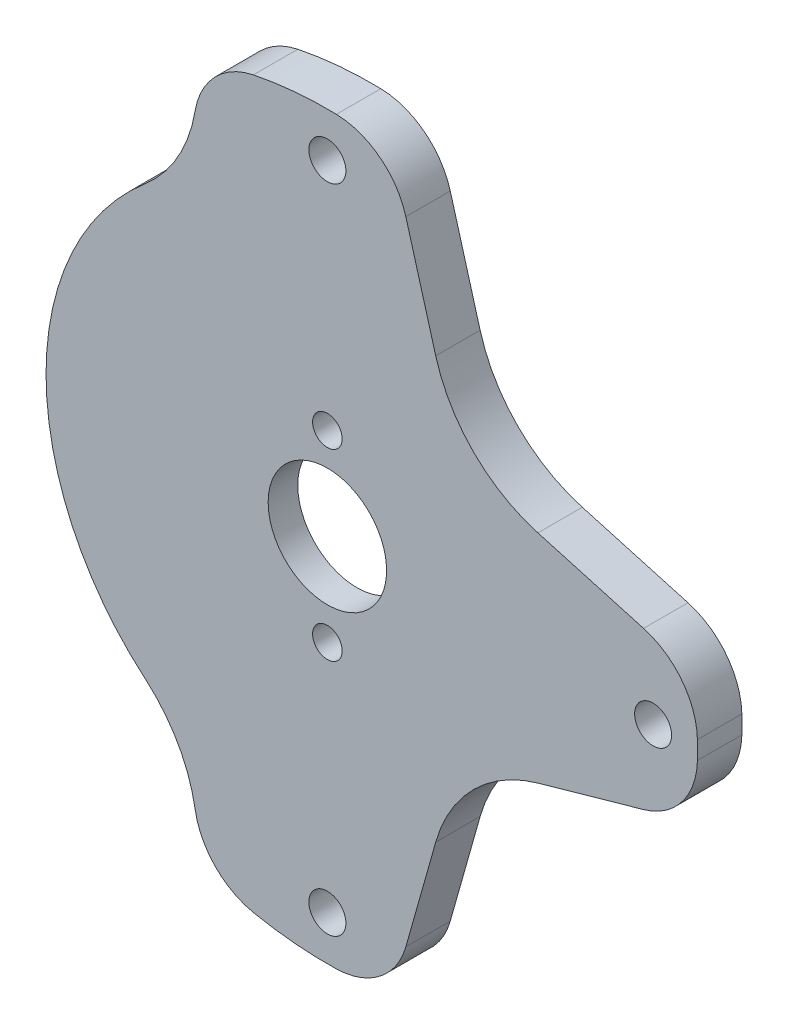
from build123d import *

# Parameters (mm, degrees)
SKETCH_1_R               = 25
SKETCH_1_R_2             = 1.25
EXTRUDE_1_DEPTH          = 3
SKETCH_3_R               = 10.5
SKETCH_3_R_2             = 4
SKETCH_3_R_3             = 1
CUT_EXTRUDE_1_DEPTH      = 1
CUT_EXTRUDE_2_DEPTH      = 36.482389998
CUT_EXTRUDE_2_DEPTH_BACK = 36.482389998
SKETCH_3_2_R             = 4
SKETCH_3_2_R_2           = 1
CUT_EXTRUDE_5_DEPTH      = 10
FILLET_2_R               = 5
FILLET_3_R               = 10


with BuildPart() as part:
    # 草图1 → 凸台-拉伸1 (new body)
    with BuildSketch(Plane.XY):
        Circle(SKETCH_1_R)
        with Locations((0, 22)):
            Circle(SKETCH_1_R_2, mode=Mode.SUBTRACT)
        with Locations((22, 0)):
            Circle(SKETCH_1_R_2, mode=Mode.SUBTRACT)
        with Locations((0, -22)):
            Circle(SKETCH_1_R_2, mode=Mode.SUBTRACT)
    extrude(amount=EXTRUDE_1_DEPTH)

    # 草图3 → 切除-拉伸1 (cut)
    with BuildSketch(Plane(origin=(0, 0, 0), x_dir=(-1, 0, 0), z_dir=(0, 0, -1))):
        Circle(SKETCH_3_R)
        Circle(SKETCH_3_R_2, mode=Mode.SUBTRACT)
        with Locations((0, 6.2)):
            Circle(SKETCH_3_R_3, mode=Mode.SUBTRACT)
        with Locations((0, -6.2)):
            Circle(SKETCH_3_R_3, mode=Mode.SUBTRACT)
    extrude(amount=-CUT_EXTRUDE_1_DEPTH, mode=Mode.SUBTRACT)

    # 草图3<2> → 切除-拉伸2 (cut, two sides: drawn at the far end of the back side and taken through both)
    with BuildSketch(Plane(origin=(0, 0, 0), x_dir=(-1, 0, 0), z_dir=(0, 0, -1)).offset(-CUT_EXTRUDE_2_DEPTH_BACK)):
        Circle(SKETCH_3_2_R)
        with Locations((0, 6.2)):
            Circle(SKETCH_3_2_R_2)
        with Locations((0, -6.2)):
            Circle(SKETCH_3_2_R_2)
    extrude(amount=CUT_EXTRUDE_2_DEPTH + CUT_EXTRUDE_2_DEPTH_BACK, mode=Mode.SUBTRACT)

    # 草图5 → 切除-拉伸5 (cut)
    with BuildSketch(Plane(origin=(0, 0, 0), x_dir=(-1, 0, 0), z_dir=(0, 0, -1))):
        with BuildLine():
            Line((-24.613742187, 4.377635842), (-8.838834765, 8.838834765))
            Line((-8.838834765, 8.838834765), (-4.377635842, 24.613742187))
            ThreePointArc((-4.377635842, 24.613742187), (-17.67766953, 17.67766953), (-24.613742187, 4.377635842))
        make_face()
        with BuildLine():
            Line((-4.377635842, -24.613742187), (-8.838834765, -8.838834765))
            Line((-8.838834765, -8.838834765), (-24.613742187, -4.377635842))
            ThreePointArc((-24.613742187, -4.377635842), (-17.67766953, -17.67766953), (-4.377635842, -24.613742187))
        make_face()
        with BuildLine():
            Line((9, -16.733200531), (9, -23.323807579))
            ThreePointArc((9, -23.323807579), (25, 0), (9, 23.323807579))
            Line((9, 23.323807579), (9, 16.733200531))
            ThreePointArc((9, 16.733200531), (19, 0), (9, -16.733200531))
        make_face()
    extrude(amount=-CUT_EXTRUDE_5_DEPTH, mode=Mode.SUBTRACT)

    # 圆角2
    fillet_2_edges = [part.edges().sort_by_distance(p)[0] for p in [
        (4.377635842, 24.613742187, 1.5),
        (4.377635842, -24.613742187, 1.5),
        (24.613742187, -4.377635842, 1.5),
        (24.613742187, 4.377635842, 1.5),
        (-9, 23.323807579, 1.5),
        (-9, -23.323807579, 1.5),
    ]]
    fillet(fillet_2_edges, radius=FILLET_2_R)

    # 圆角3
    fillet_3_edges = [part.edges().sort_by_distance(p)[0] for p in [
        (8.838834765, 8.838834765, 1.5),
        (8.838834765, -8.838834765, 1.5),
        (-9, -16.733200531, 1.5),
        (-9, 16.733200531, 1.5),
    ]]
    fillet(fillet_3_edges, radius=FILLET_3_R)


solid = part.part
